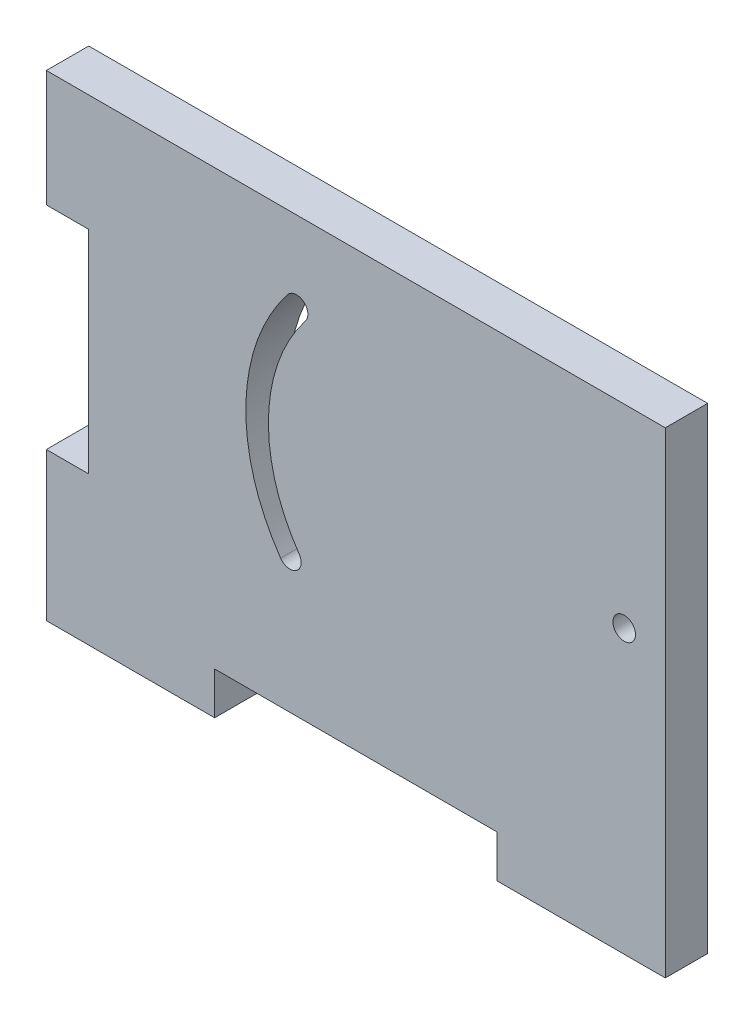
from build123d import *

# Parameters (mm, degrees)
SKETCH1_R           = 1.6
BOSS_EXTRUDE1_DEPTH = 6


with BuildPart() as part:
    # Sketch1 → Boss-Extrude1 (new body)
    with BuildSketch(Plane.XY):
        Polygon((-55.855858156, -19), (-55.855858156, -40), (-32.018263016, -40), (-32.018263016, -34), (7.981736984, -34), (7.981736984, -40), (31.819332123, -40), (31.819332123, 27.498322337), (-55.855858156, 27.498322337), (-55.855858156, 11), (-49.855858156, 11), (-49.855858156, -19), align=None)
        with BuildLine():
            ThreePointArc((-26.8550349, -6.369230763), (-27.6, 2.9e-08), (-26.855034887, 6.369230819))
            ThreePointArc((-26.855034887, 6.369230819), (-24.84706156, 12.015969866), (-21.667528577, 17.096145922))
            ThreePointArc((-21.667528577, 17.096145922), (-19.420359041, 17.361153612), (-19.15535135, 15.113984076))
            ThreePointArc((-19.15535135, 15.113984076), (-21.966242856, 10.622813883), (-23.741407682, 5.630769153))
            ThreePointArc((-23.741407682, 5.630769153), (-24.4, 3e-09), (-23.741407684, -5.630769147))
            ThreePointArc((-23.741407684, -5.630769147), (-22.28057337, -9.946660258), (-20.042787404, -13.9156988))
            ThreePointArc((-20.042787404, -13.9156988), (-20.444563705, -16.142484781), (-22.671349686, -15.740708479))
            ThreePointArc((-22.671349686, -15.740708479), (-25.202615761, -11.251140334), (-26.8550349, -6.369230763))
        make_face(mode=Mode.SUBTRACT)
        with Locations((26, 0)):
            Circle(SKETCH1_R, mode=Mode.SUBTRACT)
    extrude(amount=BOSS_EXTRUDE1_DEPTH)


solid = part.part
